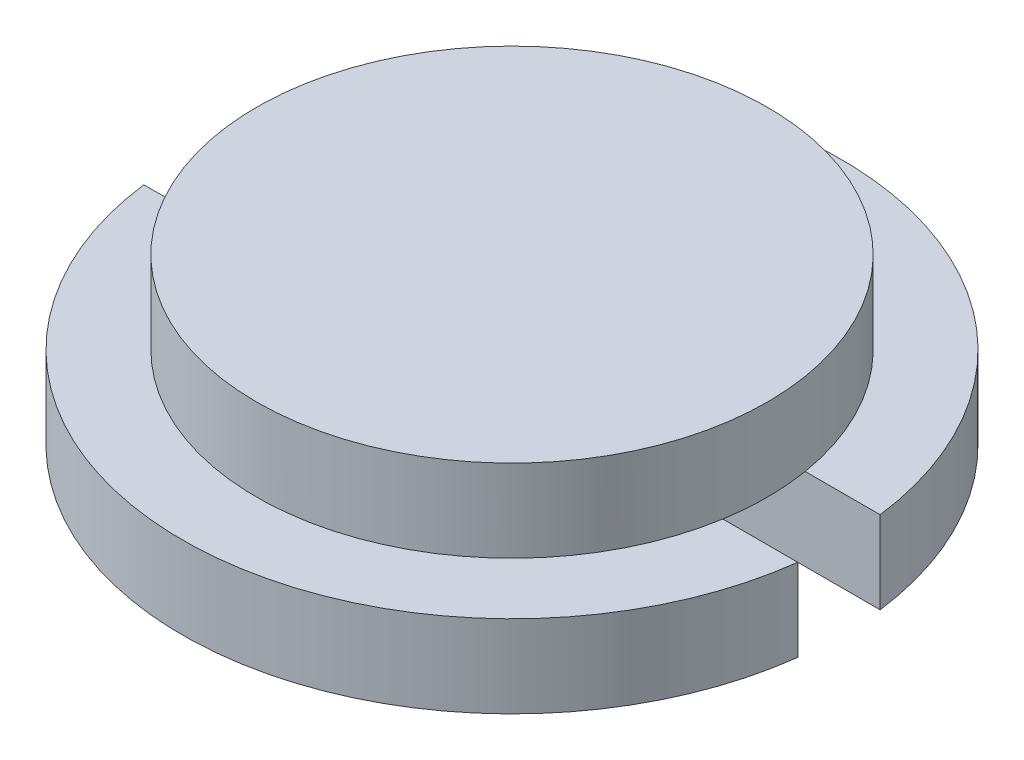
from build123d import *

# Parameters (mm, degrees)
SKETCH1_R           = 31
BOSS_EXTRUDE1_DEPTH = 10
BOSS_EXTRUDE3_DEPTH = 10
CUT_EXTRUDE2_DEPTH  = 20
SKETCH8_R           = 40
BOSS_EXTRUDE4_DEPTH = 10
SKETCH9_W           = 7.5
SKETCH9_H           = 5
BOSS_EXTRUDE5_DEPTH = 10
CUT_EXTRUDE3_DEPTH  = 10


with BuildPart() as part:
    # Sketch1 → Boss-Extrude1 (new body)
    with BuildSketch(Plane(origin=(0, 0, 0), x_dir=(1, 0, 0), z_dir=(0, 1, 0))):
        with Locations(Location((0, 0, 0), (0, 0, 270))):
            Circle(SKETCH1_R)
    extrude(amount=BOSS_EXTRUDE1_DEPTH)

    # Sketch6 → Boss-Extrude3 (add)
    with BuildSketch(Plane(origin=(0, 0, 0), x_dir=(-1, 0, 0), z_dir=(0, -1, 0))):
        Polygon((15, 0), (15, -10), (-15, -10), (-15, 0), (-15, 10), (15, 10), align=None)
    extrude(amount=BOSS_EXTRUDE3_DEPTH)

    # Sketch7 → Cut-Extrude2 (cut)
    with BuildSketch(Plane(origin=(0, 0, -10), x_dir=(-1, 0, 0), z_dir=(0, 0, -1))):
        Polygon((10, -5), (5, -5), (5, 0), (15, 0), (15, -10), align=None)
        Polygon((-5, 0), (-15, 0), (-15, -10), (-10, -5), (-5, -5), align=None)
    extrude(amount=-CUT_EXTRUDE2_DEPTH, mode=Mode.SUBTRACT)

    # Sketch8 → Boss-Extrude4 (add)
    with BuildSketch(Plane.XZ):
        with Locations(Location((0, 0, 0), (0, 0, 270))):
            Circle(SKETCH8_R)
        Polygon((15, -10), (22.5, -10), (22.5, 10), (15, 10), (-15, 10), (-22.5, 10), (-22.5, -10), (-15, -10), align=None, mode=Mode.SUBTRACT)
    extrude(amount=BOSS_EXTRUDE4_DEPTH)

    # Sketch9 → Boss-Extrude5 (add)
    with BuildSketch(Plane.XZ.offset(10)):
        with Locations((-18.75, 7.5)):
            Rectangle(SKETCH9_W, SKETCH9_H)
        with Locations((18.75, 7.5)):
            Rectangle(SKETCH9_W, SKETCH9_H)
        with Locations((18.75, -7.5)):
            Rectangle(SKETCH9_W, SKETCH9_H)
        with Locations((-18.75, -7.5)):
            Rectangle(SKETCH9_W, SKETCH9_H)
        Polygon((-15, 5), (0, 5), (15, 5), (15, 10), (-15, 10), align=None)
        Polygon((15, -10), (15, -5), (0, -5), (-15, -5), (-15, -10), align=None)
    extrude(amount=-BOSS_EXTRUDE5_DEPTH)

    # Sketch10 → Cut-Extrude3 (cut)
    with BuildSketch(Plane.XZ.offset(10)):
        Polygon((-22.5, -5), (-39.686269666, -5), (-48.180542602, -5), (-48.180542602, 5), (-22.5, 5), align=None)
        Polygon((22.5, 5), (48.180542602, 5), (48.180542602, -5), (39.686269666, -5), (22.5, -5), align=None)
    extrude(amount=-CUT_EXTRUDE3_DEPTH, mode=Mode.SUBTRACT)


solid = part.part
